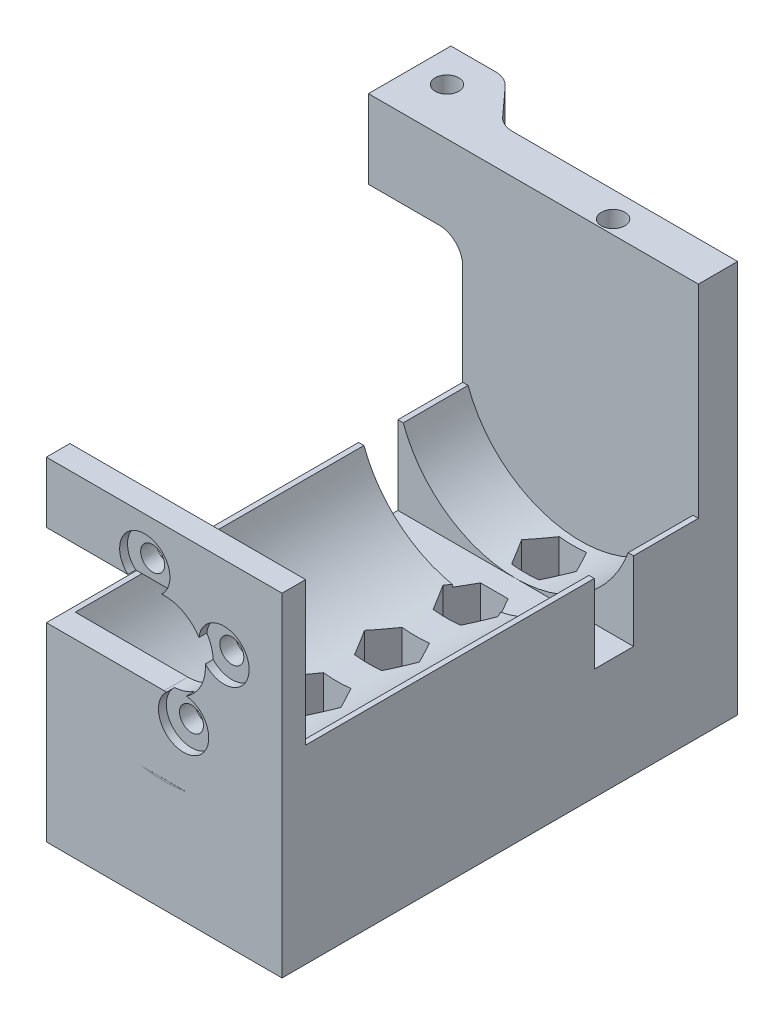
from build123d import *

# Parameters (mm, degrees)
SKETCH1_R           = 1.525
BOSS_EXTRUDE1_DEPTH = 3
BOSS_EXTRUDE2_DEPTH = 53
SKETCH3_R           = 1.55
CUT_EXTRUDE1_DEPTH  = 68.267232922
BOSS_EXTRUDE3_DEPTH = 3
CUT_EXTRUDE2_START  = -5
SKETCH5_R           = 1.55
CUT_EXTRUDE2_DEPTH  = 63.267232996
SKETCH6_R           = 3.2
CUT_EXTRUDE3_DEPTH  = 1
SKETCH7_W           = 30
SKETCH7_H           = 50
BOSS_EXTRUDE4_DEPTH = 5
SKETCH9_W           = 5
SKETCH9_H           = 20
CUT_EXTRUDE6_DEPTH  = 70.215826406
SKETCH10_R          = 6.55
CUT_EXTRUDE7_DEPTH  = 2
SKETCH11_R          = 1.5
BOSS_EXTRUDE5_DEPTH = 10
SKETCH12_R          = 1.5
CUT_EXTRUDE8_DEPTH  = 10
FILLET1_R           = 3
FILLET2_R           = 3


with BuildPart() as part:
    # Sketch1 → Boss-Extrude1 (new body)
    with BuildSketch(Plane.XY):
        with BuildLine():
            Line((-15, -15), (15, -15))
            Line((15, -15), (15, 13))
            Line((15, 13), (-15, 13))
            Line((-15, 13), (-15, 5.25))
            Line((-15, 5.25), (0, 5.25))
            ThreePointArc((0, 5.25), (3.712310601, 3.712310601), (5.25, 0))
            ThreePointArc((5.25, 0), (3.712310601, -3.712310601), (0, -5.25))
            Line((0, -5.25), (-15, -5.25))
            Line((-15, -5.25), (-15, -15))
        make_face()
        with Locations((-2.472135955, 7.60845213)):
            Circle(SKETCH1_R, mode=Mode.SUBTRACT)
        with Locations((7.60845213, 2.472135955)):
            Circle(SKETCH1_R, mode=Mode.SUBTRACT)
        with Locations((2.472135955, -7.60845213)):
            Circle(SKETCH1_R, mode=Mode.SUBTRACT)
    extrude(amount=BOSS_EXTRUDE1_DEPTH)

    # Sketch2 → Boss-Extrude2 (add)
    with BuildSketch(Plane.XY.offset(3)):
        with BuildLine():
            Line((-15, -15), (-15, -5.25))
            Line((-15, -5.25), (-14.317821063, -5.25))
            ThreePointArc((-14.317821063, -5.25), (0, -15.25), (14.317821063, -5.25))
            Line((14.317821063, -5.25), (15, -5.25))
            Line((15, -5.25), (15, -15))
            Line((15, -15), (15, -29.425))
            Line((15, -29.425), (-15, -29.425))
            Line((-15, -29.425), (-15, -15))
        make_face()
    extrude(amount=-BOSS_EXTRUDE2_DEPTH)

    # Sketch3 → Cut-Extrude1 (cut, through all)
    with BuildSketch(Plane(origin=(0, -29.425, 0), x_dir=(-1, 0, 0), z_dir=(0, -1, 0))):
        with Locations(Location((0, 46, 0), (0, 0, 90))):
            Circle(SKETCH3_R)
        with Locations(Location((0, 36, 0), (0, 0, 90))):
            Circle(SKETCH3_R)
        with Locations(Location((0, 26, 0), (0, 0, 90))):
            Circle(SKETCH3_R)
        with Locations(Location((0, 16, 0), (0, 0, 90))):
            Circle(SKETCH3_R)
        with Locations(Location((0, 6, 0), (0, 0, 90))):
            Circle(SKETCH3_R)
    extrude(amount=-CUT_EXTRUDE1_DEPTH, mode=Mode.SUBTRACT)

    # Sketch5 → Cut-Extrude2 (cut, through all)
    # profile 1 of 5: a face of its own
    with BuildSketch(Plane(origin=(0, -29.425, 0), x_dir=(-1, 0, 0), z_dir=(0, -1, 0)).offset(CUT_EXTRUDE2_START)):
        Polygon((1.746484564, 32.975), (3.492969129, 36), (1.746484564, 39.025), (-1.746484564, 39.025), (-3.492969129, 36), (-1.746484564, 32.975), align=None)
        with Locations(Location((0, 36, 0), (0, 0, 90))):
            Circle(SKETCH5_R, mode=Mode.SUBTRACT)
    # profile 2 of 5: a face of its own
    with BuildSketch(Plane(origin=(0, -29.425, 0), x_dir=(-1, 0, 0), z_dir=(0, -1, 0)).offset(CUT_EXTRUDE2_START)):
        Polygon((1.746484564, 42.975), (3.492969129, 46), (1.746484564, 49.025), (-1.746484564, 49.025), (-3.492969129, 46), (-1.746484564, 42.975), align=None)
        with Locations(Location((0, 46, 0), (0, 0, 90))):
            Circle(SKETCH5_R, mode=Mode.SUBTRACT)
    # profile 3 of 5: a face of its own
    with BuildSketch(Plane(origin=(0, -29.425, 0), x_dir=(-1, 0, 0), z_dir=(0, -1, 0)).offset(CUT_EXTRUDE2_START)):
        Polygon((1.746484564, 22.975), (3.492969129, 26), (1.746484564, 29.025), (-1.746484564, 29.025), (-3.492969129, 26), (-1.746484564, 22.975), align=None)
        with Locations(Location((0, 26, 0), (0, 0, 90))):
            Circle(SKETCH5_R, mode=Mode.SUBTRACT)
    # profile 4 of 5: a face of its own
    with BuildSketch(Plane(origin=(0, -29.425, 0), x_dir=(-1, 0, 0), z_dir=(0, -1, 0)).offset(CUT_EXTRUDE2_START)):
        Polygon((1.746484564, 12.975), (3.492969129, 16), (1.746484564, 19.025), (-1.746484564, 19.025), (-3.492969129, 16), (-1.746484564, 12.975), align=None)
        with Locations(Location((0, 16, 0), (0, 0, 90))):
            Circle(SKETCH5_R, mode=Mode.SUBTRACT)
    # profile 5 of 5: a face of its own
    with BuildSketch(Plane(origin=(0, -29.425, 0), x_dir=(-1, 0, 0), z_dir=(0, -1, 0)).offset(CUT_EXTRUDE2_START)):
        Polygon((1.746484564, 2.975), (3.492969129, 6), (1.746484564, 9.025), (-1.746484564, 9.025), (-3.492969129, 6), (-1.746484564, 2.975), align=None)
        with Locations(Location((0, 6, 0), (0, 0, 90))):
            Circle(SKETCH5_R, mode=Mode.SUBTRACT)
    extrude(amount=-CUT_EXTRUDE2_DEPTH, mode=Mode.SUBTRACT)

    # Sketch6 → Cut-Extrude3 (cut)
    with BuildSketch(Plane.XY.offset(3)):
        with Locations((2.472135955, -7.60845213)):
            Circle(SKETCH6_R)
        with Locations((-2.472135955, 7.60845213)):
            Circle(SKETCH6_R)
        with Locations((7.60845213, 2.472135955)):
            Circle(SKETCH6_R)
    extrude(amount=-CUT_EXTRUDE3_DEPTH, mode=Mode.SUBTRACT)

    # Sketch7 → Boss-Extrude4 (add)
    with BuildSketch(Plane(origin=(0, 0, -50), x_dir=(-1, 0, 0), z_dir=(0, 0, -1))):
        with Locations((0, -4.425)):
            Rectangle(SKETCH7_W, SKETCH7_H)
    extrude(amount=BOSS_EXTRUDE4_DEPTH)

    # Sketch9 → Cut-Extrude6 (cut, through all)
    with BuildSketch(Plane.ZY.offset(15)):
        with Locations((-39.25, -5.25)):
            Rectangle(SKETCH9_W, SKETCH9_H)
    extrude(amount=-CUT_EXTRUDE6_DEPTH, mode=Mode.SUBTRACT)

    # Sketch10 → Cut-Extrude7 (cut)
    with BuildSketch(Plane(origin=(0, -29.425, 0), x_dir=(-1, 0, 0), z_dir=(0, -1, 0))):
        with Locations(Location((5, 26, 0), (0, 0, 90))):
            Circle(SKETCH10_R)
    extrude(amount=-CUT_EXTRUDE7_DEPTH, mode=Mode.SUBTRACT)

    # Sketch11 → Boss-Extrude5 (add)
    with BuildSketch(Plane(origin=(0, 20.575, 0), x_dir=(1, 0, 0), z_dir=(0, 1, 0))):
        Polygon((-15, 50), (-27, 50), (-27, 60.5), (-20, 60.5), (-15, 55), align=None)
        with Locations(Location((-23, 56, 0), (0, 0, 270))):
            Circle(SKETCH11_R, mode=Mode.SUBTRACT)
    extrude(amount=-BOSS_EXTRUDE5_DEPTH)

    # Sketch12 → Cut-Extrude8 (cut)
    with BuildSketch(Plane(origin=(0, 20.575, 0), x_dir=(1, 0, 0), z_dir=(0, 1, 0))):
        with Locations(Location((2.4, 51.75, 0), (0, 0, 270))):
            Circle(SKETCH12_R)
    extrude(amount=-CUT_EXTRUDE8_DEPTH, mode=Mode.SUBTRACT)

    # Fillet1
    fillet1_edges = [part.edges().sort_by_distance(p)[0] for p in [
        (-20, 15.575, -60.5),
        (-15, 15.575, -55),
    ]]
    fillet(fillet1_edges, radius=FILLET1_R)

    # Fillet2
    fillet2_edges = [part.edges().sort_by_distance(p)[0] for p in [
        (-15, 10.575, -52.5),
    ]]
    fillet(fillet2_edges, radius=FILLET2_R)


with BuildPart() as body_2:
    # Sketch4 → Boss-Extrude3 (new body)
    with BuildSketch(Plane.XY.offset(3)):
        with BuildLine():
            Line((-2.75, -15), (2.693973064, -15.010163528))
            ThreePointArc((2.693973064, -15.010163528), (-0.028470664, -15.249973424), (-2.75, -15))
        make_face()
    extrude(amount=-BOSS_EXTRUDE3_DEPTH)


solid = Compound([part.part, body_2.part])
